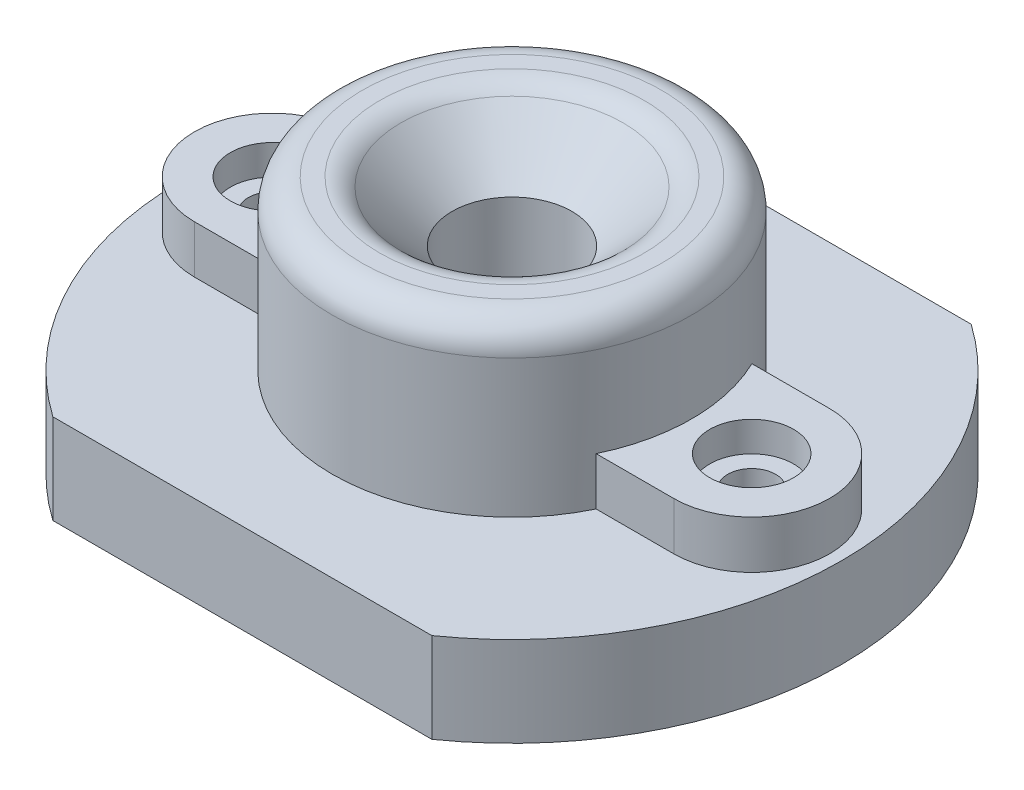
from build123d import *

# Parameters (mm, degrees)
EXTRUDE_1_DEPTH          = 15
SKETCH_9_W               = 10
SKETCH_9_H               = 33
SKETCH_12_W              = 10
SKETCH_12_H              = 28
FILLET_1_R               = 5
EXTRUDE_4_DEPTH          = 8
SKETCH_17_R              = 7
CUT_EXTRUDE_1_DEPTH      = 5
CUT_EXTRUDE_2_DEPTH      = 75.692703794
CUT_EXTRUDE_2_DEPTH_BACK = 75.692703794
SKETCH_18_R              = 4


with BuildPart() as part:
    # 草图1 → 凸台-拉伸1 (new body)
    with BuildSketch(Plane(origin=(0, 0, 0), x_dir=(1, 0, 0), z_dir=(0, 1, 0))):
        with BuildLine():
            Line((-31.622776602, 45), (31.622776602, 45))
            ThreePointArc((31.622776602, 45), (55, 0), (31.622776602, -45))
            Line((31.622776602, -45), (-31.622776602, -45))
            ThreePointArc((-31.622776602, -45), (-55, 0), (-31.622776602, 45))
        make_face()
    extrude(amount=EXTRUDE_1_DEPTH)

    # 草图9 → 旋转1 (revolve)
    with BuildSketch(Plane.XY, mode=Mode.PRIVATE) as revolve_1_sk:
        Polygon((20, 33), (20, 43), (10, 33), align=None)
        with Locations((15, 16.5)):
            Rectangle(SKETCH_9_W, SKETCH_9_H)
    revolve(revolve_1_sk.sketch.rotate(Axis((0, 0, 0), (0, 1, 0)), 90), axis=Axis((0, 0, 0), (0, 1, 0)))

    # 草图12 → 旋转2 (revolve)
    with BuildSketch(Plane.XY, mode=Mode.PRIVATE) as revolve_2_sk:
        with Locations((25, 29)):
            Rectangle(SKETCH_12_W, SKETCH_12_H)
    revolve(revolve_2_sk.sketch.rotate(Axis((0, 0, 0), (0, 1, 0)), 90), axis=Axis((0, 0, 0), (0, 1, 0)))

    # 圆角1
    fillet_1_edges = [part.edges().sort_by_distance(p)[0] for p in [
        (0, 43, 20),
        (0, 43, 30),
    ]]
    fillet(fillet_1_edges, radius=FILLET_1_R)

    # 草图14 → 凸台-拉伸4 (add)
    with BuildSketch(Plane(origin=(0, 15, 0), x_dir=(1, 0, 0), z_dir=(0, 1, 0))):
        with BuildLine():
            Line((-27.037011669, 13), (-40, 13))
            ThreePointArc((-40, 13), (-53, 0), (-40, -13))
            Line((-40, -13), (-27.037011669, -13))
            ThreePointArc((-27.037011669, -13), (-29.249874787, -6.666695205), (-30, 0))
            ThreePointArc((-30, 0), (-29.249874787, 6.666695205), (-27.037011669, 13))
        make_face()
        with BuildLine():
            Line((27.037011669, -13), (40, -13))
            ThreePointArc((40, -13), (53, 0), (40, 13))
            Line((40, 13), (27.037011669, 13))
            ThreePointArc((27.037011669, 13), (30, 0), (27.037011669, -13))
        make_face()
    extrude(amount=EXTRUDE_4_DEPTH)

    # 草图17 → 切除-拉伸1 (cut)
    with BuildSketch(Plane(origin=(0, 23, 0), x_dir=(1, 0, 0), z_dir=(0, 1, 0))):
        with Locations(Location((-40, 0, 0), (0, 0, 270))):
            Circle(SKETCH_17_R)
        with Locations(Location((40, 0, 0), (0, 0, 270))):
            Circle(SKETCH_17_R)
    extrude(amount=-CUT_EXTRUDE_1_DEPTH, mode=Mode.SUBTRACT)

    # 草图18 → 切除-拉伸2 (cut, two sides: drawn at the far end of the back side and taken through both)
    with BuildSketch(Plane(origin=(0, 23, 0), x_dir=(1, 0, 0), z_dir=(0, 1, 0)).offset(-CUT_EXTRUDE_2_DEPTH_BACK)):
        with Locations(Location((-40, 0, 0), (0, 0, 270))):
            Circle(SKETCH_18_R)
        with Locations(Location((40, 0, 0), (0, 0, 270))):
            Circle(SKETCH_18_R)
    extrude(amount=CUT_EXTRUDE_2_DEPTH + CUT_EXTRUDE_2_DEPTH_BACK, mode=Mode.SUBTRACT)


solid = part.part
